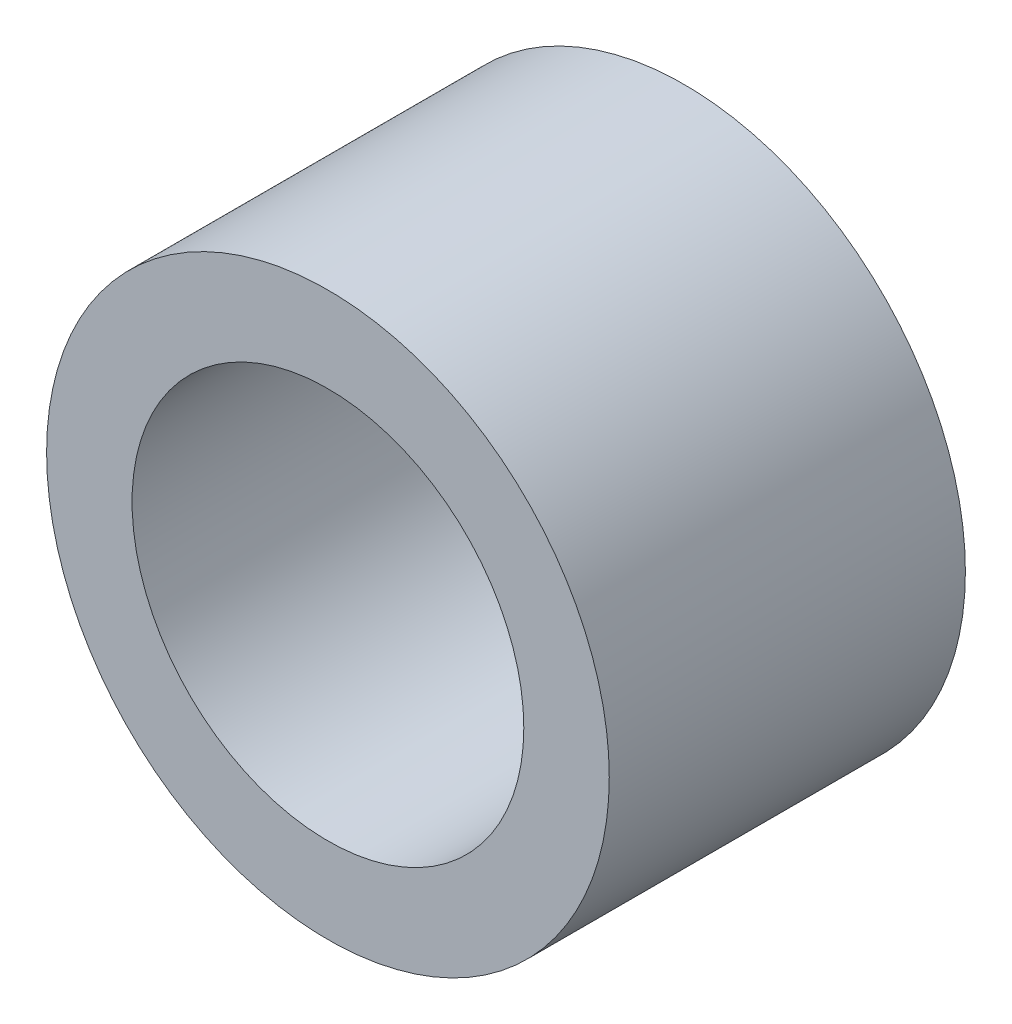
from build123d import *

# Parameters (mm, degrees)
SKETCH1_R           = 3.95
BOSS_EXTRUDE1_DEPTH = 5
SKETCH2_R           = 2.75
CUT_EXTRUDE1_DEPTH  = 5


with BuildPart() as part:
    # Sketch1 → Boss-Extrude1 (new body)
    with BuildSketch(Plane.XY):
        Circle(SKETCH1_R)
    extrude(amount=BOSS_EXTRUDE1_DEPTH)

    # Sketch2 → Cut-Extrude1 (cut)
    with BuildSketch(Plane.XY.offset(5)):
        Circle(SKETCH2_R)
    extrude(amount=-CUT_EXTRUDE1_DEPTH, mode=Mode.SUBTRACT)


solid = part.part
